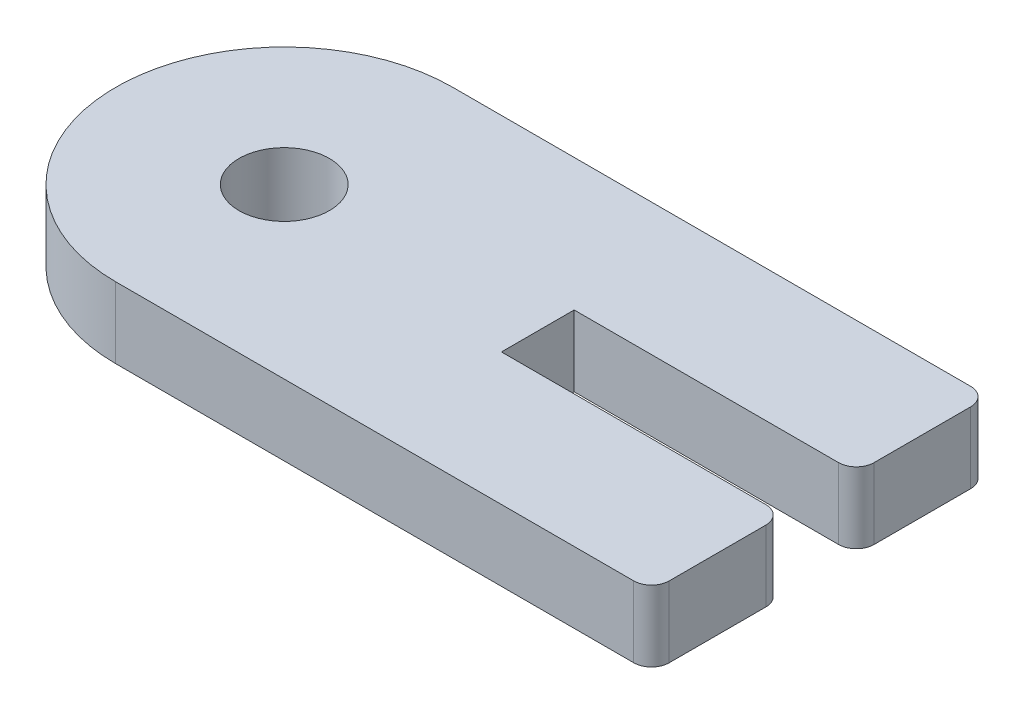
from build123d import *

# Parameters (mm, degrees)
SKETCH1_R           = 2.55
BOSS_EXTRUDE1_DEPTH = 4


with BuildPart() as part:
    # Sketch1 → Boss-Extrude1 (new body)
    with BuildSketch(Plane(origin=(0, 0, 0), x_dir=(1, 0, 0), z_dir=(0, 1, 0))):
        with BuildLine():
            Line((27.06, 2.05), (12.15, 2.05))
            Line((12.15, 2.05), (12.15, -2.05))
            Line((12.15, -2.05), (27.06, -2.05))
            ThreePointArc((27.06, -2.05), (27.767106781, -2.342893219), (28.06, -3.05))
            Line((28.06, -3.05), (28.06, -8.5))
            ThreePointArc((28.06, -8.5), (27.767106781, -9.207106781), (27.06, -9.5))
            Line((27.06, -9.5), (-2.15, -9.5))
            ThreePointArc((-2.15, -9.5), (-11.65, 0), (-2.15, 9.5))
            Line((-2.15, 9.5), (27.06, 9.5))
            ThreePointArc((27.06, 9.5), (27.767106781, 9.207106781), (28.06, 8.5))
            Line((28.06, 8.5), (28.06, 3.05))
            ThreePointArc((28.06, 3.05), (27.767106781, 2.342893219), (27.06, 2.05))
        make_face()
        with Locations(Location((-2.15, 0, 0), (0, 0, 270))):
            Circle(SKETCH1_R, mode=Mode.SUBTRACT)
    extrude(amount=BOSS_EXTRUDE1_DEPTH)


solid = part.part
